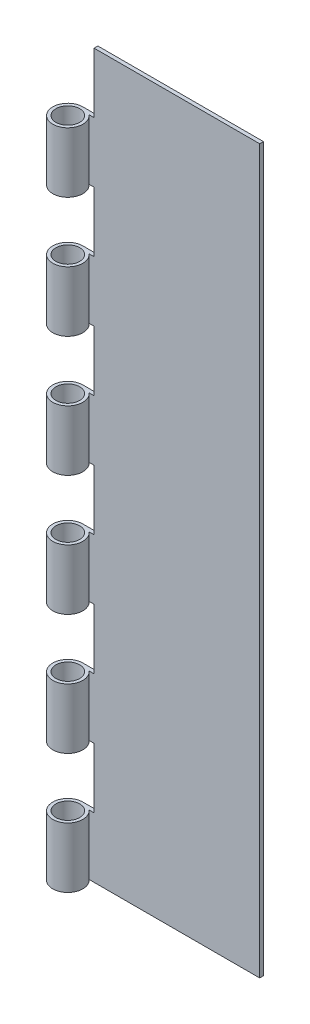
from build123d import *

# Parameters (mm, degrees)
SKETCH1_W               = 76.2
SKETCH1_H               = 304.8
BOSS_EXTRUDE1_DEPTH     = 1.5875
SKETCH2_R               = 6.35
BOSS_EXTRUDE2_DEPTH     = 304.8
CUT_EXTRUDE1_REACH      = 310.693
SKETCH5_R               = 5.020069527
CUT_EXTRUDE2_DEPTH      = 22.4155
CUT_EXTRUDE2_DEPTH_BACK = 22.4155
SKETCH6_W               = 31.253930699
SKETCH6_H               = 25.4
SKETCH6_W_2             = 35.598147882
SKETCH6_W_3             = 29.083231171


with BuildPart() as part:
    # Sketch1 → Boss-Extrude1 (new body)
    with BuildSketch(Plane.XY):
        with Locations((-2.744516439, 43.403238015)):
            Rectangle(SKETCH1_W, SKETCH1_H)
    extrude(amount=BOSS_EXTRUDE1_DEPTH)

    # Sketch2 → Boss-Extrude2 (add)
    with BuildSketch(Plane(origin=(0, 195.803238015, 0), x_dir=(1, 0, 0), z_dir=(0, 1, 0))):
        with Locations((-40.844516439, -6.35)):
            Circle(SKETCH2_R)
    extrude(amount=-BOSS_EXTRUDE2_DEPTH)

    # Sketch5 → Cut-Extrude1 (cut, up to next)
    with BuildSketch(Plane(origin=(0, 195.803238015, 0), x_dir=(1, 0, 0), z_dir=(0, 1, 0)), mode=Mode.PRIVATE) as cut_extrude1_sk1:
        with Locations(Location((-40.844516439, -6.35, 0), (0, 0, 270))):
            Circle(SKETCH5_R)
    cut_extrude1_tool1 = extrude(cut_extrude1_sk1.sketch, amount=-CUT_EXTRUDE1_REACH, mode=Mode.PRIVATE) & part.part
    add(cut_extrude1_tool1.solids().sort_by_distance((-40.844516, 195.803238, 6.35))[0], mode=Mode.SUBTRACT)

    # Sketch6 → Cut-Extrude2 (cut, two sides: drawn at the far end of the back side and taken through both)
    with BuildSketch(Plane.XY.offset(1.5875).offset(-CUT_EXTRUDE2_DEPTH_BACK)):
        with Locations((-50.121481789, 183.103238015)):
            Rectangle(SKETCH6_W, SKETCH6_H)
        with Locations((-50.121481789, 132.303238015)):
            Rectangle(SKETCH6_W, SKETCH6_H)
        with Locations((-50.121481789, 81.503238015)):
            Rectangle(SKETCH6_W, SKETCH6_H)
        with Locations((-50.121481789, 30.703238015)):
            Rectangle(SKETCH6_W, SKETCH6_H)
        with Locations((-52.29359038, -20.096761985)):
            Rectangle(SKETCH6_W_2, SKETCH6_H)
        with Locations((-49.036132025, -70.896761985)):
            Rectangle(SKETCH6_W_3, SKETCH6_H)
    extrude(amount=CUT_EXTRUDE2_DEPTH + CUT_EXTRUDE2_DEPTH_BACK, mode=Mode.SUBTRACT)


solid = part.part
